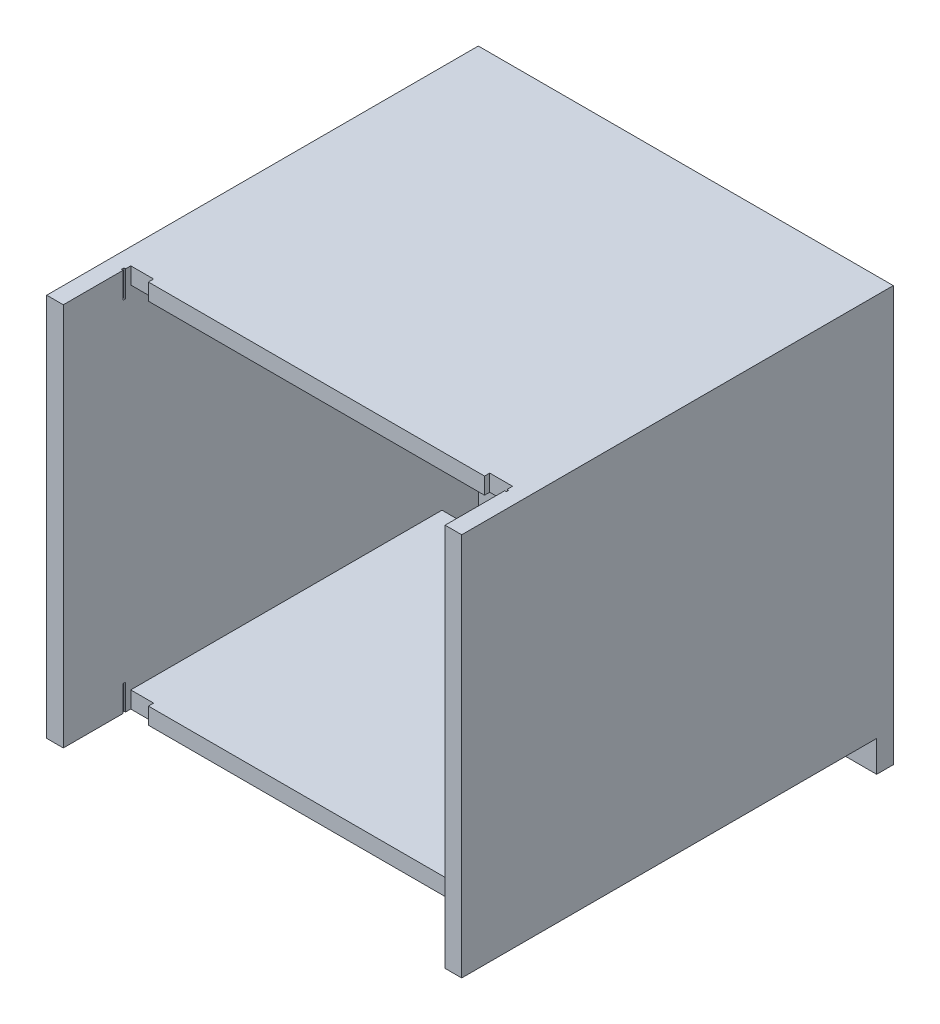
from build123d import *

# Parameters (mm, degrees)
SKETCH_1_W               = 400
SKETCH_1_H               = 400
EXTRUDE_1_DEPTH          = 16
SKETCH_2_W               = 16
SKETCH_2_H               = 370
EXTRUDE_2_DEPTH          = 400
SKETCH_3_W               = 16
SKETCH_3_H               = 370
EXTRUDE_3_DEPTH          = 400
SKETCH_4_W               = 368
SKETCH_4_H               = 16
EXTRUDE_4_DEPTH          = 340
EXTRUDE_5_REACH          = 687.53
SKETCH_6_W               = 305
SKETCH_6_H               = 16
SKETCH_7_W               = 22
SKETCH_7_H               = 16
CUT_EXTRUDE_1_DEPTH      = 5
SKETCH_14_W              = 22
SKETCH_14_H              = 16
CUT_EXTRUDE_2_DEPTH      = 5
SKETCH_15_W              = 1.5
SKETCH_15_H              = 2.5
CUT_EXTRUDE_3_DEPTH      = 25
MIRROR_4_COPY_1_SKETCH_W = 1.5
MIRROR_4_COPY_1_SKETCH_H = 2.5
MIRROR_4_COPY_1_DEPTH    = 25
MIRROR_4_COPY_2_SKETCH_W = 1.5
MIRROR_4_COPY_2_SKETCH_H = 2.5
MIRROR_4_COPY_2_DEPTH    = 25
MIRROR_4_COPY_3_SKETCH_W = 1.5
MIRROR_4_COPY_3_SKETCH_H = 2.5
MIRROR_4_COPY_3_DEPTH    = 25
MIRROR_4_COPY_4_SKETCH_W = 1.5
MIRROR_4_COPY_4_SKETCH_H = 2.5
MIRROR_4_COPY_4_DEPTH    = 25


with BuildPart() as part:
    # 草图1 → 凸台-拉伸1 (new body)
    with BuildSketch(Plane.XY):
        with Locations((186.413251901, 186.573625287)):
            Rectangle(SKETCH_1_W, SKETCH_1_H)
    extrude(amount=EXTRUDE_1_DEPTH)

    # 草图2 → 凸台-拉伸2 (add)
    with BuildSketch(Plane.XY.offset(16)):
        with Locations((-5.586748099, 201.573625287)):
            Rectangle(SKETCH_2_W, SKETCH_2_H)
    extrude(amount=EXTRUDE_2_DEPTH)

    # 草图3 → 凸台-拉伸3 (add)
    with BuildSketch(Plane.XY.offset(16)):
        with Locations((378.413251901, 201.573625287)):
            Rectangle(SKETCH_3_W, SKETCH_3_H)
    extrude(amount=EXTRUDE_3_DEPTH)

    # 草图4 → 凸台-拉伸4 (add)
    with BuildSketch(Plane.XY.offset(16)):
        with Locations((186.413251901, 378.573625287)):
            Rectangle(SKETCH_4_W, SKETCH_4_H)
    extrude(amount=EXTRUDE_4_DEPTH)

    # 草图6 → 凸台-拉伸5 (add, up to next)
    with BuildSketch(Plane.ZY.offset(-370.413251901), mode=Mode.PRIVATE) as extrude_5_sk1:
        with Locations((203.5, 24.573625287)):
            Rectangle(SKETCH_6_W, SKETCH_6_H)
    extrude_5_tool1 = extrude(extrude_5_sk1.sketch, amount=EXTRUDE_5_REACH, mode=Mode.PRIVATE) - part.part
    add(extrude_5_tool1.solids().sort_by_distance((370.413252, 24.573625, 203.5))[0])

    # 草图7 → 切除-拉伸1 (cut)
    with BuildSketch(Plane.XY.offset(356)):
        with Locations((359.413251901, 24.573625287)):
            Rectangle(SKETCH_7_W, SKETCH_7_H)
    cut_extrude_1 = extrude(amount=-CUT_EXTRUDE_1_DEPTH, mode=Mode.SUBTRACT)

    # 草图14 → 切除-拉伸2 (cut)
    with BuildSketch(Plane.XY.offset(356)):
        with Locations((13.413251901, 24.573625287)):
            Rectangle(SKETCH_14_W, SKETCH_14_H)
    cut_extrude_2 = extrude(amount=-CUT_EXTRUDE_2_DEPTH, mode=Mode.SUBTRACT)

    # 镜向1: 切除-拉伸1, 切除-拉伸2 across plane
    add(cut_extrude_1.mirror(Plane(origin=(0, 201.573625287, 0), x_dir=(0, 0, 1), z_dir=(0, -1, 0))), mode=Mode.SUBTRACT)
    add(cut_extrude_2.mirror(Plane(origin=(0, 201.573625287, 0), x_dir=(0, 0, 1), z_dir=(0, -1, 0))), mode=Mode.SUBTRACT)

    # 草图15 → 切除-拉伸3 (cut)
    with BuildSketch(Plane.XZ.offset(-16.573625287)):
        with Locations((1.663251901, 357.25)):
            Rectangle(SKETCH_15_W, SKETCH_15_H)
    cut_extrude_3 = extrude(amount=-CUT_EXTRUDE_3_DEPTH, mode=Mode.SUBTRACT)

    # 镜向2: 切除-拉伸3 across plane
    add(cut_extrude_3.mirror(Plane(origin=(0, 201.573625287, 0), x_dir=(0, 0, 1), z_dir=(0, -1, 0))), mode=Mode.SUBTRACT)

    # 镜向3: 切除-拉伸3 across plane
    add(cut_extrude_3.mirror(Plane(origin=(186.413251901, 0, 0), x_dir=(0, 0, 1), z_dir=(1, 0, 0))), mode=Mode.SUBTRACT)

    # 镜向4 copy 1 sketch → 镜向4 copy 1 (cut)
    with BuildSketch(Plane.XZ.offset(-16.573625287)):
        with Locations((1.663251901, 357.25)):
            Rectangle(MIRROR_4_COPY_1_SKETCH_W, MIRROR_4_COPY_1_SKETCH_H)
    extrude(amount=-MIRROR_4_COPY_1_DEPTH, mode=Mode.SUBTRACT)

    # 镜向4 copy 2 sketch → 镜向4 copy 2 (cut)
    with BuildSketch(Plane(origin=(0, 386.573625287, 0), x_dir=(1, 0, 0), z_dir=(0, 1, 0))):
        with Locations((1.663251901, -357.25)):
            Rectangle(MIRROR_4_COPY_2_SKETCH_W, MIRROR_4_COPY_2_SKETCH_H)
    extrude(amount=-MIRROR_4_COPY_2_DEPTH, mode=Mode.SUBTRACT)

    # 镜向4 copy 3 sketch → 镜向4 copy 3 (cut)
    with BuildSketch(Plane(origin=(372.826503801, 386.573625287, 0), x_dir=(-1, 0, 0), z_dir=(0, 1, 0))):
        with Locations((1.663251901, 357.25)):
            Rectangle(MIRROR_4_COPY_3_SKETCH_W, MIRROR_4_COPY_3_SKETCH_H)
    extrude(amount=-MIRROR_4_COPY_3_DEPTH, mode=Mode.SUBTRACT)

    # 镜向4 copy 4 sketch → 镜向4 copy 4 (cut)
    with BuildSketch(Plane(origin=(0, 386.573625287, 0), x_dir=(1, 0, 0), z_dir=(0, 1, 0))):
        with Locations((1.663251901, -357.25)):
            Rectangle(MIRROR_4_COPY_4_SKETCH_W, MIRROR_4_COPY_4_SKETCH_H)
    extrude(amount=-MIRROR_4_COPY_4_DEPTH, mode=Mode.SUBTRACT)


solid = part.part
